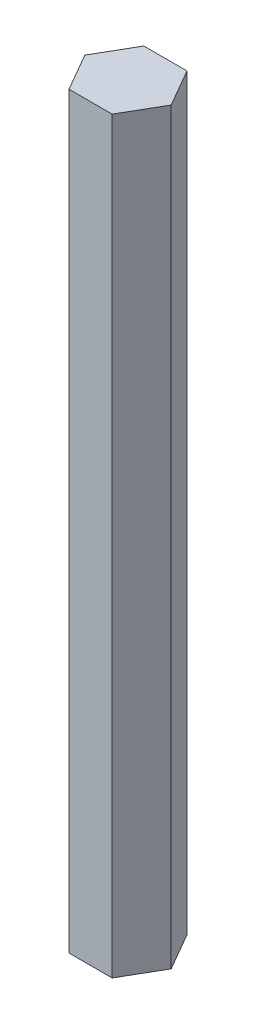
from build123d import *

# Parameters (mm, degrees)
BOSS_EXTRUDE1_DEPTH = 63.5


with BuildPart() as part:
    # Sketch1 → Boss-Extrude1 (new, symmetric)
    with BuildSketch(Plane(origin=(0, 0, 0), x_dir=(1, 0, 0), z_dir=(0, 1, 0))):
        Polygon((7.332348419, 0), (3.666174209, 6.35), (-3.666174209, 6.35), (-7.332348419, 0), (-3.666174209, -6.35), (3.666174209, -6.35), align=None)
    extrude(amount=BOSS_EXTRUDE1_DEPTH, both=True)


solid = part.part
